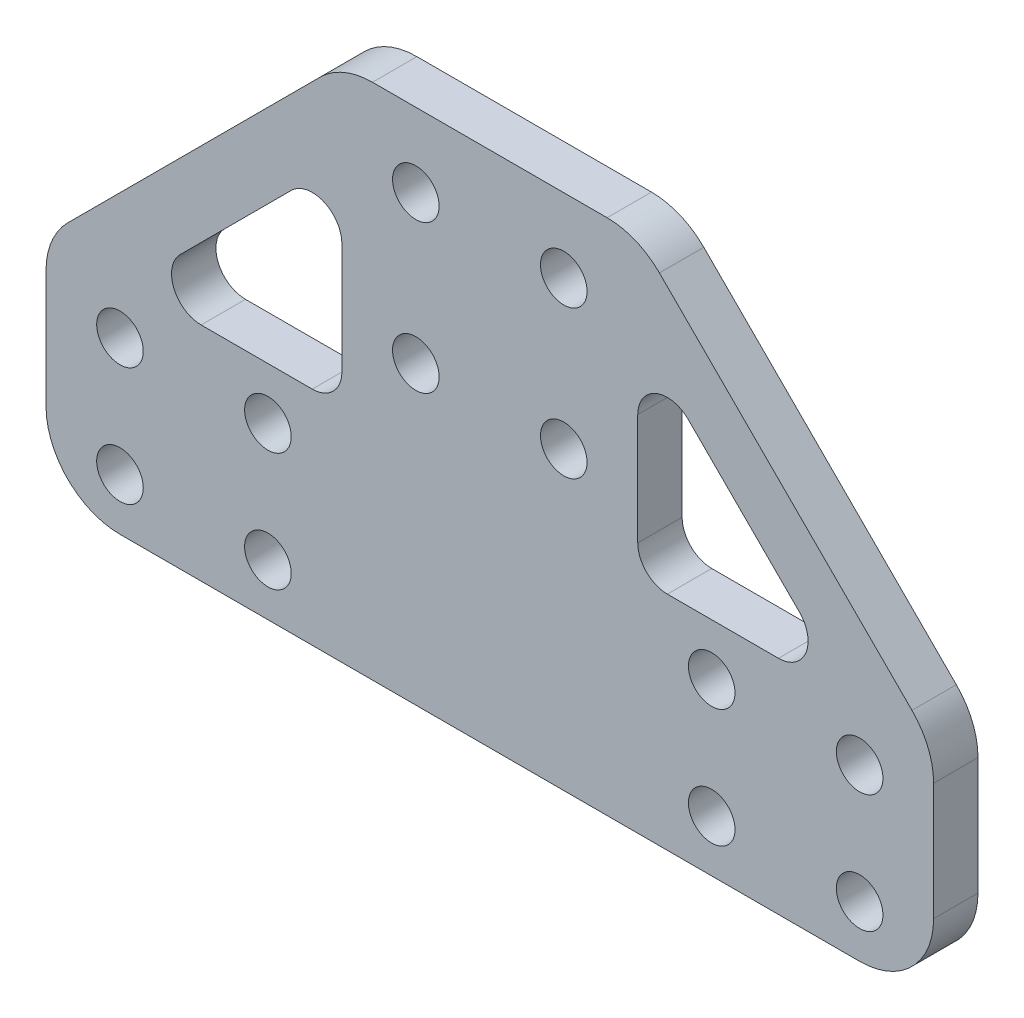
from build123d import *

# Parameters (mm, degrees)
EXTRUDE_1_DEPTH     = 3
SKETCH_2_R          = 1.575
CUT_EXTRUDE_1_DEPTH = 54.235326617
FILLET_1_R          = 2
FILLET_2_R          = 5


with BuildPart() as part:
    # 草图1 → 凸台-拉伸1 (new body)
    with BuildSketch(Plane.XY):
        Polygon((0, 0), (20, 0), (40, -20), (40, -35), (-20, -35), (-20, -20), align=None)
    extrude(amount=EXTRUDE_1_DEPTH)

    # 草图2 → 切除-拉伸1 (cut, through all)
    with BuildSketch(Plane.XY.offset(3)):
        with Locations((5, -5)):
            Circle(SKETCH_2_R)
        with Locations(Location((15, -5, 0), (0, 0, 180))):
            Circle(SKETCH_2_R)
        with Locations((15, -15)):
            Circle(SKETCH_2_R)
        with Locations(Location((5, -15, 0), (0, 0, 180))):
            Circle(SKETCH_2_R)
        with Locations((-15, -31.5)):
            Circle(SKETCH_2_R)
        with Locations(Location((-15, -23.5, 0), (0, 0, 180))):
            Circle(SKETCH_2_R)
        with Locations(Location((-5, -31.5, 0), (0, 0, 180))):
            Circle(SKETCH_2_R)
        with Locations((-5, -23.5)):
            Circle(SKETCH_2_R)
        with Locations((25, -31.5)):
            Circle(SKETCH_2_R)
        with Locations(Location((35, -31.5, 0), (0, 0, 180))):
            Circle(SKETCH_2_R)
        with Locations(Location((25, -23.5, 0), (0, 0, 180))):
            Circle(SKETCH_2_R)
        with Locations((35, -23.5)):
            Circle(SKETCH_2_R)
        Polygon((0, -5.656854249), (0, -20), (-14.343145751, -20), align=None)
        Polygon((34.343145751, -20), (20, -5.656854249), (20, -20), align=None)
    extrude(amount=-CUT_EXTRUDE_1_DEPTH, mode=Mode.SUBTRACT)

    # 圆角1
    fillet_1_edges = [part.edges().sort_by_distance(p)[0] for p in [
        (34.343145751, -20, 1.5),
        (20, -20, 1.5),
        (20, -5.656854249, 1.5),
        (-14.343145751, -20, 1.5),
        (0, -5.656854249, 1.5),
        (0, -20, 1.5),
    ]]
    fillet(fillet_1_edges, radius=FILLET_1_R)

    # 圆角2
    fillet_2_edges = [part.edges().sort_by_distance(p)[0] for p in [
        (0, 0, 1.5),
        (20, 0, 1.5),
        (40, -20, 1.5),
        (40, -35, 1.5),
        (-20, -35, 1.5),
        (-20, -20, 1.5),
    ]]
    fillet(fillet_2_edges, radius=FILLET_2_R)


solid = part.part
